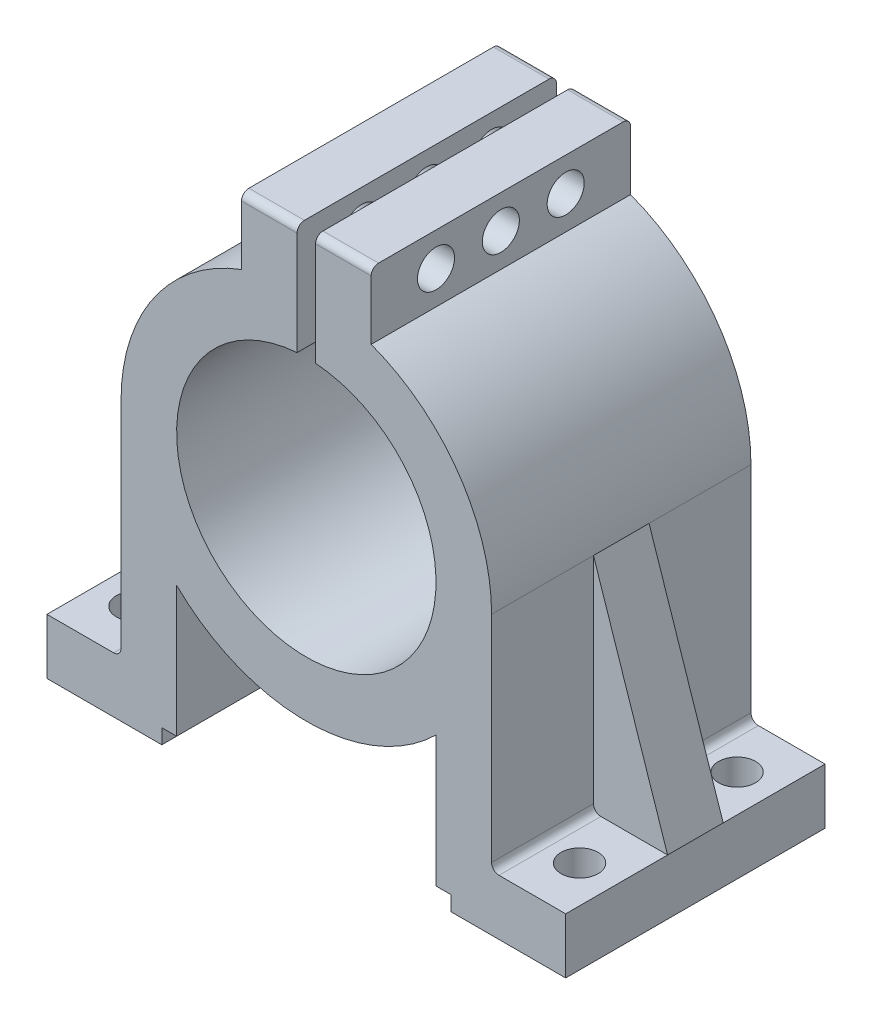
from build123d import *

# Parameters (mm, degrees)
SKETCH1_R                = 20
SKETCH1_R_2              = 14
BOSS_EXTRUDE1_DEPTH      = 14
BOSS_EXTRUDE2_DEPTH      = 28
SKETCH3_W                = 1.6
SKETCH3_H                = 1.6
CUT_EXTRUDE1_DEPTH       = 50.678969393
FILLET1_R                = 0.8
BOSS_EXTRUDE3_DEPTH      = 14
BOSS_EXTRUDE3_DEPTH_BACK = 14
SKETCH5_W                = 2
SKETCH5_H                = 28
CUT_EXTRUDE2_DEPTH       = 25
SKETCH6_R                = 2
CUT_EXTRUDE3_DEPTH       = 49.176757882
FILLET2_R                = 0.8
RIB1_REACH               = 45.359
SKETCH7_WALL_W           = 114.016154836
SKETCH7_WALL_H           = 6
SKETCH8_R                = 2
CUT_EXTRUDE4_DEPTH       = 59.936437162
SKETCH9_W                = 2
SKETCH9_H                = 14
CUT_EXTRUDE5_DEPTH       = 31


with BuildPart() as part:
    # Sketch1 → Boss-Extrude1 (new, symmetric)
    with BuildSketch(Plane.XY):
        Circle(SKETCH1_R)
        Circle(SKETCH1_R_2, mode=Mode.SUBTRACT)
    extrude(amount=BOSS_EXTRUDE1_DEPTH, both=True)

    # Sketch2 → Boss-Extrude2 (add)
    with BuildSketch(Plane.XY.offset(14)):
        with BuildLine():
            Line((-20, 0), (-20, -24))
            Line((-20, -24), (-28, -24))
            Line((-28, -24), (-28, -30))
            Line((-28, -30), (-14, -30))
            Line((-14, -30), (-14, -14.282856857))
            ThreePointArc((-14, -14.282856857), (-18.439088915, -7.745966692), (-20, 0))
        make_face()
        with BuildLine():
            Line((14, -30), (14, -14.282856857))
            ThreePointArc((14, -14.282856857), (18.439088915, -7.745966692), (20, 0))
            Line((20, 0), (20, -24))
            Line((20, -24), (28, -24))
            Line((28, -24), (28, -30))
            Line((28, -30), (14, -30))
        make_face()
    extrude(amount=-BOSS_EXTRUDE2_DEPTH)

    # Sketch3 → Cut-Extrude1 (cut, through all)
    with BuildSketch(Plane.XY.offset(14)):
        with Locations((-14.8, -29.2)):
            Rectangle(SKETCH3_W, SKETCH3_H)
        with Locations((14.8, -29.2)):
            Rectangle(SKETCH3_W, SKETCH3_H)
    extrude(amount=-CUT_EXTRUDE1_DEPTH, mode=Mode.SUBTRACT)

    # Fillet1
    fillet1_edges = [part.edges().sort_by_distance(p)[0] for p in [
        (-20, -24, 0),
        (20, -24, 0),
    ]]
    fillet(fillet1_edges, radius=FILLET1_R)

    # Sketch4 → Boss-Extrude3 (add, two sides: drawn at the far end of the back side and taken through both)
    with BuildSketch(Plane.XY.offset(-BOSS_EXTRUDE3_DEPTH_BACK)):
        with BuildLine():
            Line((-7, 18.734993995), (-7, 25.934993995))
            Line((-7, 25.934993995), (7, 25.934993995))
            Line((7, 25.934993995), (7, 18.734993995))
            ThreePointArc((7, 18.734993995), (0, 20), (-7, 18.734993995))
        make_face()
    extrude(amount=BOSS_EXTRUDE3_DEPTH + BOSS_EXTRUDE3_DEPTH_BACK)

    # Sketch5 → Cut-Extrude2 (cut)
    with BuildSketch(Plane(origin=(0, 25.934993995, 0), x_dir=(1, 0, 0), z_dir=(0, 1, 0))):
        with Locations((0, -14)):
            Rectangle(SKETCH5_W, SKETCH5_H)
    extrude(amount=-CUT_EXTRUDE2_DEPTH, mode=Mode.SUBTRACT)

    # Sketch6 → Cut-Extrude3 (cut, through all)
    with BuildSketch(Plane(origin=(7, 0, 0), x_dir=(0, 0, -1), z_dir=(1, 0, 0))):
        with Locations((0, 22.334993995)):
            Circle(SKETCH6_R)
        with Locations((-7, 22.334993995)):
            Circle(SKETCH6_R)
        with Locations((7, 22.334993995)):
            Circle(SKETCH6_R)
    extrude(amount=-CUT_EXTRUDE3_DEPTH, mode=Mode.SUBTRACT)

    # Fillet2
    fillet2_edges = [part.edges().sort_by_distance(p)[0] for p in [
        (-4, 25.934993995, 14),
        (0, 25.934993995, -14),
        (4, 25.934993995, 14),
    ]]
    fillet(fillet2_edges, radius=FILLET2_R)

    # Sketch7 wall → Rib1 (add, up to next)
    with BuildSketch(Plane(origin=(24, -12, 0), x_dir=(0.316227766017, -0.948683298051, 0), z_dir=(0.948683298051, 0.316227766017, 0)), mode=Mode.PRIVATE) as rib1_sk1:
        Rectangle(SKETCH7_WALL_W, SKETCH7_WALL_H)
    rib1_tool1 = extrude(rib1_sk1.sketch, amount=-RIB1_REACH, mode=Mode.PRIVATE) - part.part
    rib1 = rib1_tool1.solids().sort_by_distance((24, -12, 0))[0]
    add(rib1)

    # Sketch8 → Cut-Extrude4 (cut, through all)
    with BuildSketch(Plane(origin=(0, -24, 0), x_dir=(1, 0, 0), z_dir=(0, 1, 0))):
        with Locations(Location((24, 8.5, 0), (0, 0, 270))):
            Circle(SKETCH8_R)
        with Locations(Location((24, -8.5, 0), (0, 0, 270))):
            Circle(SKETCH8_R)
    cut_extrude4 = extrude(amount=-CUT_EXTRUDE4_DEPTH, mode=Mode.SUBTRACT)

    # Mirror1: Rib1, Cut-Extrude4 across plane
    add(rib1.mirror(Plane(origin=(0, 0, 0), x_dir=(0, 0, 1), z_dir=(1, 0, 0))))
    add(cut_extrude4.mirror(Plane(origin=(0, 0, 0), x_dir=(0, 0, 1), z_dir=(1, 0, 0))), mode=Mode.SUBTRACT)

    # Sketch9 → Cut-Extrude5 (cut)
    with BuildSketch(Plane(origin=(0, 25.934993995, 0), x_dir=(1, 0, 0), z_dir=(0, 1, 0))):
        with Locations((0, 7)):
            Rectangle(SKETCH9_W, SKETCH9_H)
    extrude(amount=-CUT_EXTRUDE5_DEPTH, mode=Mode.SUBTRACT)


solid = part.part
